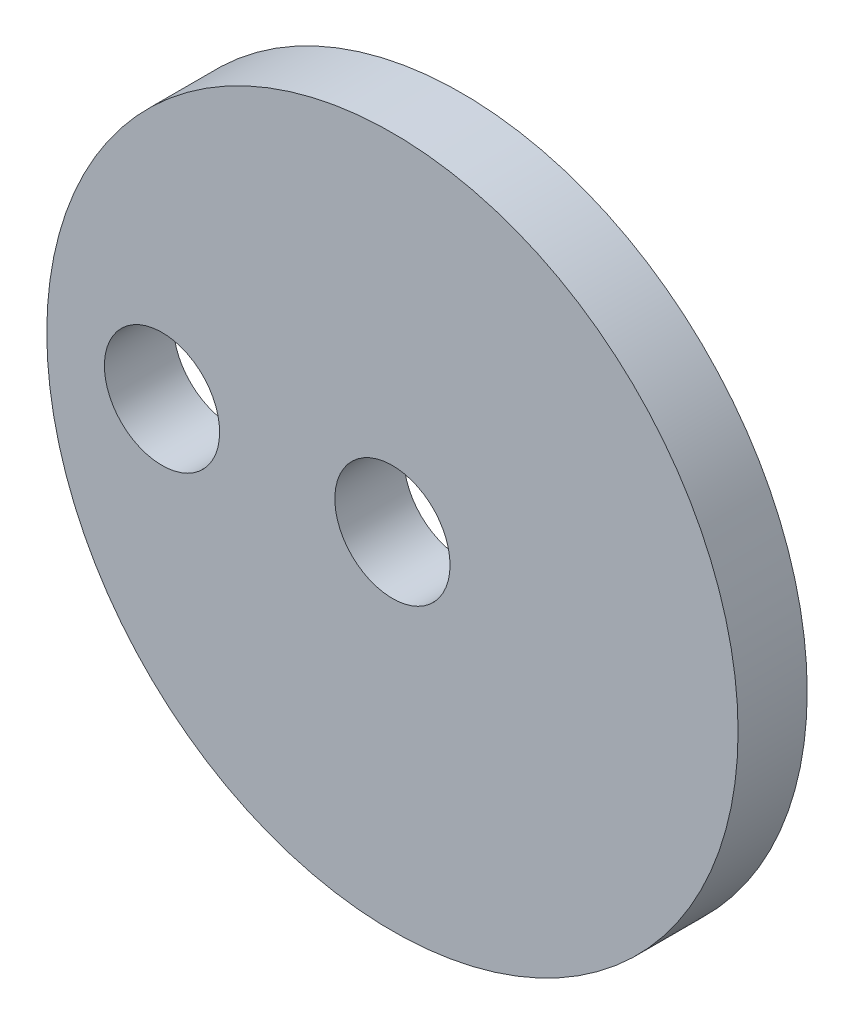
from build123d import *

# Parameters (mm, degrees)
SKETCH1_R           = 15
BOSS_EXTRUDE1_DEPTH = 3
SKETCH2_R           = 2.5
CUT_EXTRUDE1_DEPTH  = 3


with BuildPart() as part:
    # Sketch1 → Boss-Extrude1 (new body)
    with BuildSketch(Plane.XY):
        Circle(SKETCH1_R)
    extrude(amount=BOSS_EXTRUDE1_DEPTH)

    # Sketch2 → Cut-Extrude1 (cut)
    with BuildSketch(Plane.XY.offset(3)):
        Circle(SKETCH2_R)
        with Locations((-10, 0)):
            Circle(SKETCH2_R)
    extrude(amount=-CUT_EXTRUDE1_DEPTH, mode=Mode.SUBTRACT)


solid = part.part
